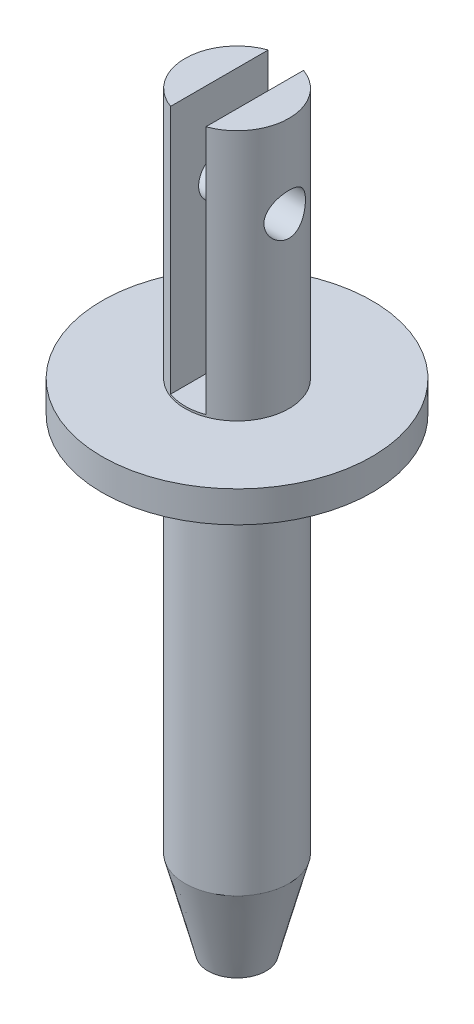
from build123d import *

# Parameters (mm, degrees)
SKETCH1_R           = 2.5
BOSS_EXTRUDE1_DEPTH = 36.1
SKETCH2_W           = 1.7
SKETCH2_H           = 6.818294784
CUT_EXTRUDE1_DEPTH  = 12
SKETCH3_R           = 1
CUT_EXTRUDE2_DEPTH  = 6
CHAMFER1_SIZE       = 1.1
CHAMFER1_SIZE2      = 4.2
SKETCH5_W           = 4
SKETCH5_H           = 1.5


with BuildPart() as part:
    # Sketch1 → Boss-Extrude1 (new body)
    with BuildSketch(Plane(origin=(0, 0, 0), x_dir=(1, 0, 0), z_dir=(0, 1, 0))):
        with Locations(Location((0, 0, 0), (0, 0, 270))):
            Circle(SKETCH1_R)
    extrude(amount=BOSS_EXTRUDE1_DEPTH)

    # Sketch2 → Cut-Extrude1 (cut)
    with BuildSketch(Plane(origin=(0, 36.1, 0), x_dir=(1, 0, 0), z_dir=(0, 1, 0))):
        Rectangle(SKETCH2_W, SKETCH2_H)
    extrude(amount=-CUT_EXTRUDE1_DEPTH, mode=Mode.SUBTRACT)

    # Sketch3 → Cut-Extrude2 (cut, symmetric)
    with BuildSketch(Plane(origin=(-0.85, 0, 0), x_dir=(0, 0, -1), z_dir=(1, 0, 0))):
        with Locations((0, 32.1)):
            Circle(SKETCH3_R)
    extrude(amount=CUT_EXTRUDE2_DEPTH, both=True, mode=Mode.SUBTRACT)

    # Chamfer1
    chamfer1_edges = [part.edges().sort_by_distance(p)[0] for p in [
        (0, 0, -2.5),
    ]]
    chamfer1_side = [part.faces().sort_by_distance(p)[0] for p in [
        (0, 0, 0),
    ]]
    chamfer(chamfer1_edges, length=CHAMFER1_SIZE, length2=CHAMFER1_SIZE2, reference=chamfer1_side[0])

    # Sketch5 → Revolve1 (revolve)
    with BuildSketch(Plane(origin=(0, 0, 0), x_dir=(0, 0, -1), z_dir=(1, 0, 0))):
        with Locations((-4.5, 23.247432375)):
            Rectangle(SKETCH5_W, SKETCH5_H)
    revolve(axis=Axis((0, 50, 0), (0, -1, 0)))


solid = part.part
